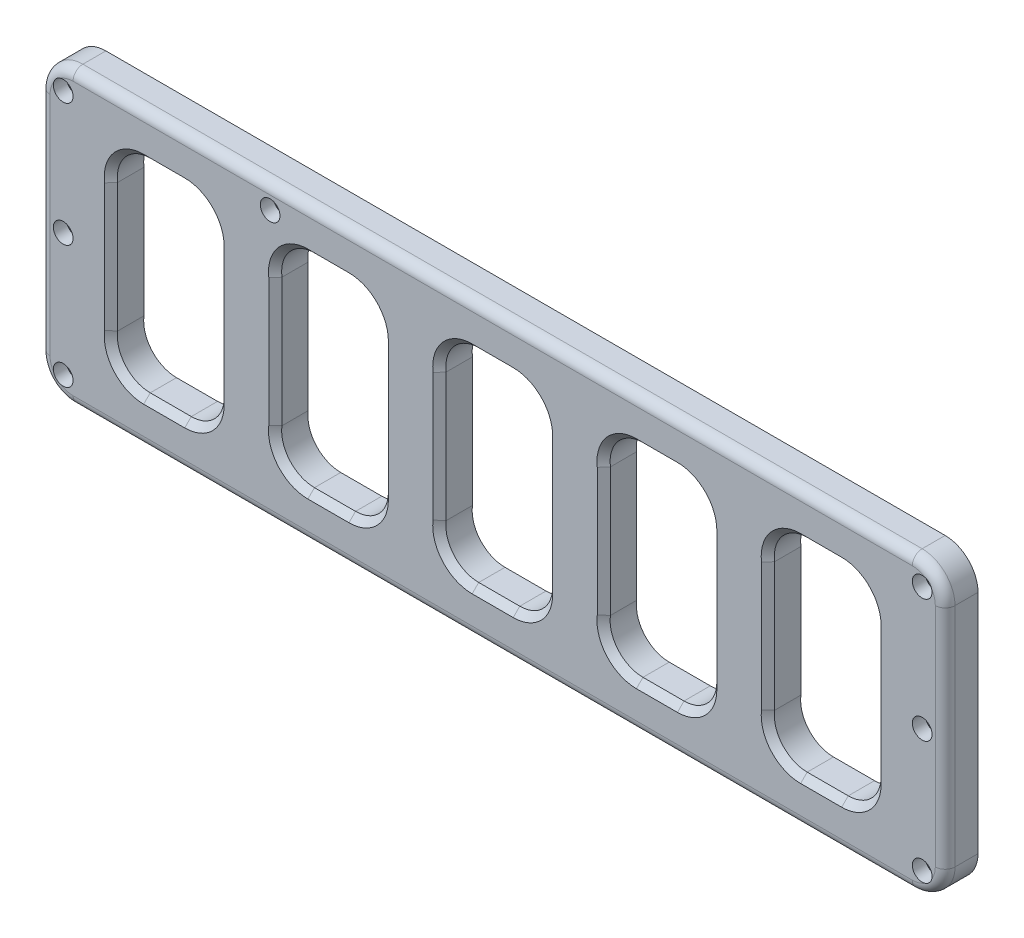
from build123d import *

# Parameters (mm, degrees)
SKETCH_1_W          = 275.5
SKETCH_1_H          = 88.9
EXTRUDE_1_DEPTH     = 10
FILLET_1_R          = 10
CUT_EXTRUDE_1_DEPTH = 10
CHAMFER_2_SIZE      = 2
FILLET_3_R          = 3
SKETCH_3_W          = 255.5
SKETCH_3_H          = 3
CUT_EXTRUDE_2_DEPTH = 4
SKETCH_4_R          = 1.5
CUT_EXTRUDE_3_DEPTH = 46
CUT_EXTRUDE_START   = -4
SKETCH_5_R          = 3
SKETCH_5_R_2        = 1.5
CUT_EXTRUDE_4_DEPTH = 4
SKETCH_6_W          = 135.5
SKETCH_6_H          = 3
EXTRUDE_2_DEPTH     = 3


with BuildPart() as part:
    # 草图1 → 凸台-拉伸1 (new body)
    with BuildSketch(Plane.XY):
        Rectangle(SKETCH_1_W, SKETCH_1_H)
    extrude(amount=EXTRUDE_1_DEPTH)

    # 圆角1
    fillet_1_edges = [part.edges().sort_by_distance(p)[0] for p in [
        (137.75, -44.45, 5),
        (-137.75, -44.45, 5),
        (-137.75, 44.45, 5),
        (137.75, 44.45, 5),
    ]]
    fillet(fillet_1_edges, radius=FILLET_1_R)

    # 草图2 → 切除-拉伸1 (cut)
    with BuildSketch(Plane.XY.offset(10)):
        with BuildLine():
            Line((-6.25, 30.95), (6.25, 30.95))
            ThreePointArc((6.25, 30.95), (13.321067812, 28.021067812), (16.25, 20.95))
            Line((16.25, 20.95), (16.25, -20.95))
            ThreePointArc((16.25, -20.95), (13.321067812, -28.021067812), (6.25, -30.95))
            Line((6.25, -30.95), (-6.25, -30.95))
            ThreePointArc((-6.25, -30.95), (-13.787950414, -27.521096069), (-16.156519268, -19.58586071))
            Line((-16.156519268, -19.58586071), (-16.156519268, 19.58586071))
            ThreePointArc((-16.156519268, 19.58586071), (-13.787950414, 27.521096069), (-6.25, 30.95))
        make_face()
        with BuildLine():
            Line((-43.75, -30.95), (-56.25, -30.95))
            ThreePointArc((-56.25, -30.95), (-63.787950414, -27.521096069), (-66.156519268, -19.58586071))
            Line((-66.156519268, -19.58586071), (-66.156519268, 19.58586071))
            ThreePointArc((-66.156519268, 19.58586071), (-63.787950414, 27.521096069), (-56.25, 30.95))
            Line((-56.25, 30.95), (-43.75, 30.95))
            ThreePointArc((-43.75, 30.95), (-36.678932188, 28.021067812), (-33.75, 20.95))
            Line((-33.75, 20.95), (-33.75, -20.95))
            ThreePointArc((-33.75, -20.95), (-36.678932188, -28.021067812), (-43.75, -30.95))
        make_face()
        with BuildLine():
            Line((56.25, -30.95), (43.75, -30.95))
            ThreePointArc((43.75, -30.95), (36.212049586, -27.521096069), (33.843480732, -19.58586071))
            Line((33.843480732, -19.58586071), (33.843480732, 19.58586071))
            ThreePointArc((33.843480732, 19.58586071), (36.212049586, 27.521096069), (43.75, 30.95))
            Line((43.75, 30.95), (56.25, 30.95))
            ThreePointArc((56.25, 30.95), (63.321067812, 28.021067812), (66.25, 20.95))
            Line((66.25, 20.95), (66.25, -20.95))
            ThreePointArc((66.25, -20.95), (63.321067812, -28.021067812), (56.25, -30.95))
        make_face()
        with BuildLine():
            Line((106.25, -30.95), (93.75, -30.95))
            ThreePointArc((93.75, -30.95), (86.212049586, -27.521096069), (83.843480732, -19.58586071))
            Line((83.843480732, -19.58586071), (83.843480732, 19.58586071))
            ThreePointArc((83.843480732, 19.58586071), (86.212049586, 27.521096069), (93.75, 30.95))
            Line((93.75, 30.95), (106.25, 30.95))
            ThreePointArc((106.25, 30.95), (113.321067812, 28.021067812), (116.25, 20.95))
            Line((116.25, 20.95), (116.25, -20.95))
            ThreePointArc((116.25, -20.95), (113.321067812, -28.021067812), (106.25, -30.95))
        make_face()
        with BuildLine():
            Line((-93.75, -30.95), (-106.25, -30.95))
            ThreePointArc((-106.25, -30.95), (-113.787950414, -27.521096069), (-116.156519268, -19.58586071))
            Line((-116.156519268, -19.58586071), (-116.156519268, 19.58586071))
            ThreePointArc((-116.156519268, 19.58586071), (-113.787950414, 27.521096069), (-106.25, 30.95))
            Line((-106.25, 30.95), (-93.75, 30.95))
            ThreePointArc((-93.75, 30.95), (-86.678932188, 28.021067812), (-83.75, 20.95))
            Line((-83.75, 20.95), (-83.75, -20.95))
            ThreePointArc((-83.75, -20.95), (-86.678932188, -28.021067812), (-93.75, -30.95))
        make_face()
    extrude(amount=-CUT_EXTRUDE_1_DEPTH, mode=Mode.SUBTRACT)

    # 倒角2
    chamfer_2_edges = [part.edges().sort_by_distance(p)[0] for p in [
        (86.212049586, 27.521096069, 10),
        (83.843480732, 0, 10),
        (86.212049586, -27.521096069, 10),
        (100, -30.95, 10),
        (113.321067812, -28.021067812, 10),
        (116.25, 0, 10),
        (113.321067812, 28.021067812, 10),
        (100, 30.95, 10),
        (-113.787950414, 27.521096069, 10),
        (-116.156519268, 0, 10),
        (-113.787950414, -27.521096069, 10),
        (-100, -30.95, 10),
        (-86.678932188, -28.021067812, 10),
        (-83.75, 0, 10),
        (-86.678932188, 28.021067812, 10),
        (-100, 30.95, 10),
        (-13.787950414, 27.521096069, 10),
        (-16.156519268, 0, 10),
        (-13.787950414, -27.521096069, 10),
        (0, -30.95, 10),
        (13.321067812, -28.021067812, 10),
        (16.25, 0, 10),
        (13.321067812, 28.021067812, 10),
        (0, 30.95, 10),
        (36.212049586, 27.521096069, 10),
        (33.843480732, 0, 10),
        (36.212049586, -27.521096069, 10),
        (50, -30.95, 10),
        (63.321067812, -28.021067812, 10),
        (66.25, 0, 10),
        (63.321067812, 28.021067812, 10),
        (50, 30.95, 10),
        (-63.787950414, 27.521096069, 10),
        (-66.156519268, 0, 10),
        (-63.787950414, -27.521096069, 10),
        (-50, -30.95, 10),
        (-36.678932188, -28.021067812, 10),
        (-33.75, 0, 10),
        (-36.678932188, 28.021067812, 10),
        (-50, 30.95, 10),
    ]]
    chamfer(chamfer_2_edges, length=CHAMFER_2_SIZE)

    # 圆角3
    fillet_3_edges = [part.edges().sort_by_distance(p)[0] for p in [
        (0, -44.45, 10),
        (-137.75, 0, 10),
        (137.75, 0, 10),
        (0, 44.45, 10),
        (-134.821067812, 41.521067812, 10),
        (134.821067812, 41.521067812, 10),
        (134.821067812, -41.521067812, 10),
        (-134.821067812, -41.521067812, 10),
    ]]
    fillet(fillet_3_edges, radius=FILLET_3_R)

    # 草图3 → 切除-拉伸2 (cut)
    with BuildSketch(Plane(origin=(0, 0, 0), x_dir=(-1, 0, 0), z_dir=(0, 0, -1))):
        with Locations((0, -40.45)):
            Rectangle(SKETCH_3_W, SKETCH_3_H)
    extrude(amount=-CUT_EXTRUDE_2_DEPTH, mode=Mode.SUBTRACT)

    # 草图4 → 切除-拉伸3 (cut)
    with BuildSketch(Plane(origin=(0, 0, 0), x_dir=(-1, 0, 0), z_dir=(0, 0, -1))):
        with Locations((-130.75, 37.45)):
            Circle(SKETCH_4_R)
        with Locations((130.75, 37.45)):
            Circle(SKETCH_4_R)
        with Locations((130.75, -37.45)):
            Circle(SKETCH_4_R)
        with Locations((-130.75, -37.45)):
            Circle(SKETCH_4_R)
        with Locations((67.75, 37.45)):
            Circle(SKETCH_4_R)
        with Locations((-130.75, 0)):
            Circle(SKETCH_4_R)
        with Locations((130.75, 0)):
            Circle(SKETCH_4_R)
    extrude(amount=-CUT_EXTRUDE_3_DEPTH, mode=Mode.SUBTRACT)

    # 草图5 → 切除-拉伸4 (cut)
    # profile 1 of 7: a face of its own
    with BuildSketch(Plane.XY.offset(10).offset(CUT_EXTRUDE_START)):
        with Locations((-67.75, 37.45)):
            Circle(SKETCH_5_R)
        with Locations(Location((-67.75, 37.45, 0), (0, 0, 180))):
            Circle(SKETCH_5_R_2, mode=Mode.SUBTRACT)
    # profile 2 of 7: a face of its own
    with BuildSketch(Plane.XY.offset(10).offset(CUT_EXTRUDE_START)):
        with Locations((130.75, 0)):
            Circle(SKETCH_5_R)
        with Locations(Location((130.75, 0, 0), (0, 0, 180))):
            Circle(SKETCH_5_R_2, mode=Mode.SUBTRACT)
    # profile 3 of 7: a face of its own
    with BuildSketch(Plane.XY.offset(10).offset(CUT_EXTRUDE_START)):
        with Locations((-130.75, 0)):
            Circle(SKETCH_5_R)
        with Locations(Location((-130.75, 0, 0), (0, 0, 180))):
            Circle(SKETCH_5_R_2, mode=Mode.SUBTRACT)
    # profile 4 of 7: a face of its own
    with BuildSketch(Plane.XY.offset(10).offset(CUT_EXTRUDE_START)):
        with Locations((-130.75, 37.45)):
            Circle(SKETCH_5_R)
        with Locations(Location((-130.75, 37.45, 0), (0, 0, 180))):
            Circle(SKETCH_5_R_2, mode=Mode.SUBTRACT)
    # profile 5 of 7: a face of its own
    with BuildSketch(Plane.XY.offset(10).offset(CUT_EXTRUDE_START)):
        with Locations((-130.75, -37.45)):
            Circle(SKETCH_5_R)
        with Locations(Location((-130.75, -37.45, 0), (0, 0, 180))):
            Circle(SKETCH_5_R_2, mode=Mode.SUBTRACT)
    # profile 6 of 7: a face of its own
    with BuildSketch(Plane.XY.offset(10).offset(CUT_EXTRUDE_START)):
        with Locations((130.75, 37.45)):
            Circle(SKETCH_5_R)
        with Locations(Location((130.75, 37.45, 0), (0, 0, 180))):
            Circle(SKETCH_5_R_2, mode=Mode.SUBTRACT)
    # profile 7 of 7: a face of its own
    with BuildSketch(Plane.XY.offset(10).offset(CUT_EXTRUDE_START)):
        with Locations((130.75, -37.45)):
            Circle(SKETCH_5_R)
        with Locations(Location((130.75, -37.45, 0), (0, 0, 180))):
            Circle(SKETCH_5_R_2, mode=Mode.SUBTRACT)
    extrude(amount=CUT_EXTRUDE_4_DEPTH, mode=Mode.SUBTRACT)

    # 草图6 → 凸台-拉伸2 (add)
    with BuildSketch(Plane(origin=(0, 0, 0), x_dir=(-1, 0, 0), z_dir=(0, 0, -1))):
        with Locations((-10, 39.45)):
            Rectangle(SKETCH_6_W, SKETCH_6_H)
    extrude(amount=EXTRUDE_2_DEPTH)


solid = part.part
